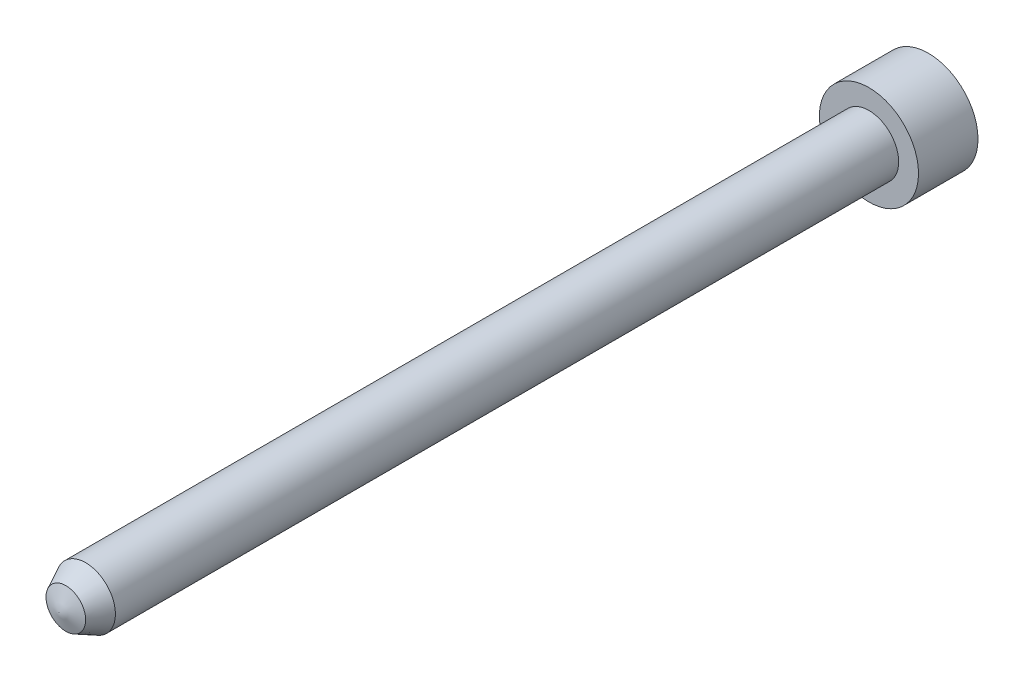
from build123d import *

# Parameters (mm, degrees)
EXTRUDE_START      = 300
EXTRUDE_SKETCH_1_R = 15
EXTRUDE_1_DEPTH    = 18
EXTRUDE_START_2    = 318
EXTRUDE_SKETCH_2_R = 9
EXTRUDE_2_DEPTH    = 237


with BuildPart() as part:
    # Extrude sketch 1 → Extrude 1 (new body)
    with BuildSketch(Plane.XY.offset(EXTRUDE_START)):
        with Locations((860, -225)):
            Circle(EXTRUDE_SKETCH_1_R)
    extrude(amount=EXTRUDE_1_DEPTH)


with BuildPart() as body_2:
    # Extrude sketch 2 → Extrude 2 (new body)
    with BuildSketch(Plane.XY.offset(EXTRUDE_START_2)):
        with Locations((860, -225)):
            Circle(EXTRUDE_SKETCH_2_R)
    extrude(amount=EXTRUDE_2_DEPTH)


with BuildPart() as body_3:
    # Revolve profile 1 → Revolve 1 (revolve)
    with BuildSketch(Plane(origin=(0, -225, 0), x_dir=(1, 0, 0), z_dir=(0, 1, 0))):
        Polygon((860, -555), (869, -555), (866, -561), (860, -563), align=None)
    revolve(axis=Axis((860, -225, 550), (0, 0, 1)))


with BuildPart() as part_1:
    add(part.part)

    # Combine (weld / assembly of features): union body 2, body 3
    add(body_2.part)
    add(body_3.part)


solid = part_1.part
